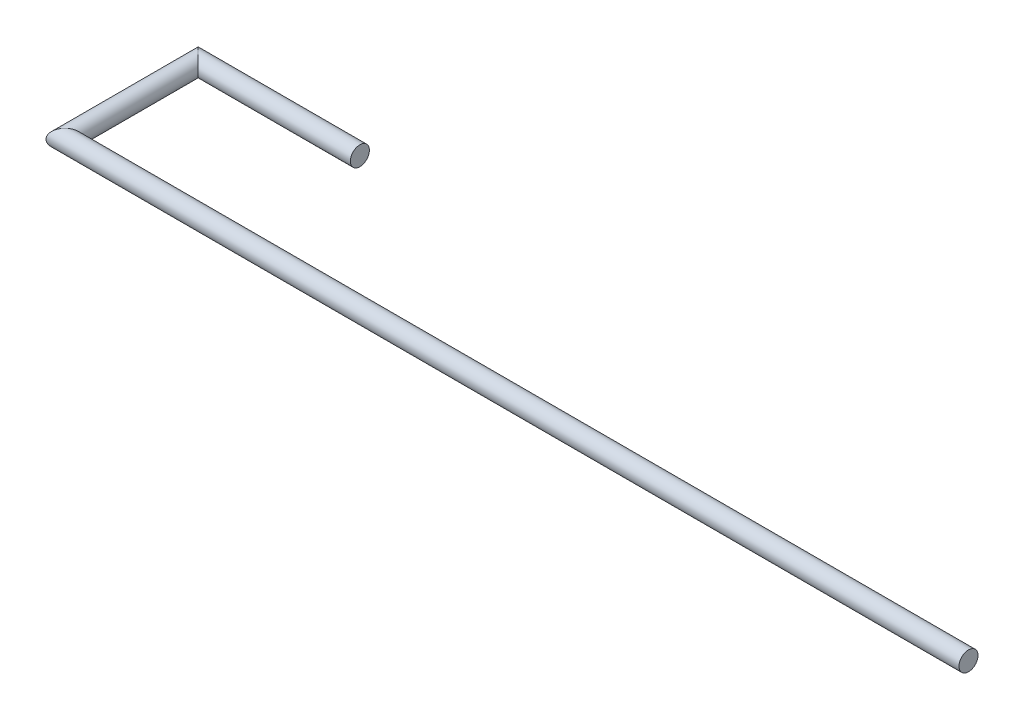
from build123d import *

# Parameters (mm, degrees)
SWEEP3_PROFILE_R = 2.5


with BuildPart() as part:
    # Sweep3: sweep along a path in Sketch1
    with BuildLine(Plane(origin=(0, 0, 0), x_dir=(1, 0, 0), z_dir=(0, 1, 0))) as sweep3_path:
        Line((40, 2.5), (-2.5, 2.5))
        Line((-2.5, 2.5), (-2.5, -32.5))
        Line((-2.5, -32.5), (234.975667779, -32.5))
    # Sweep3 profile (on start of the path) → Sweep3 (sweep)
    with BuildSketch(Plane(origin=(40, 0, -2.5), x_dir=(0, 0, -1), z_dir=(-1, 0, 0))):
        Circle(SWEEP3_PROFILE_R)
    sweep(path=sweep3_path.line, transition=Transition.RIGHT)


solid = part.part
